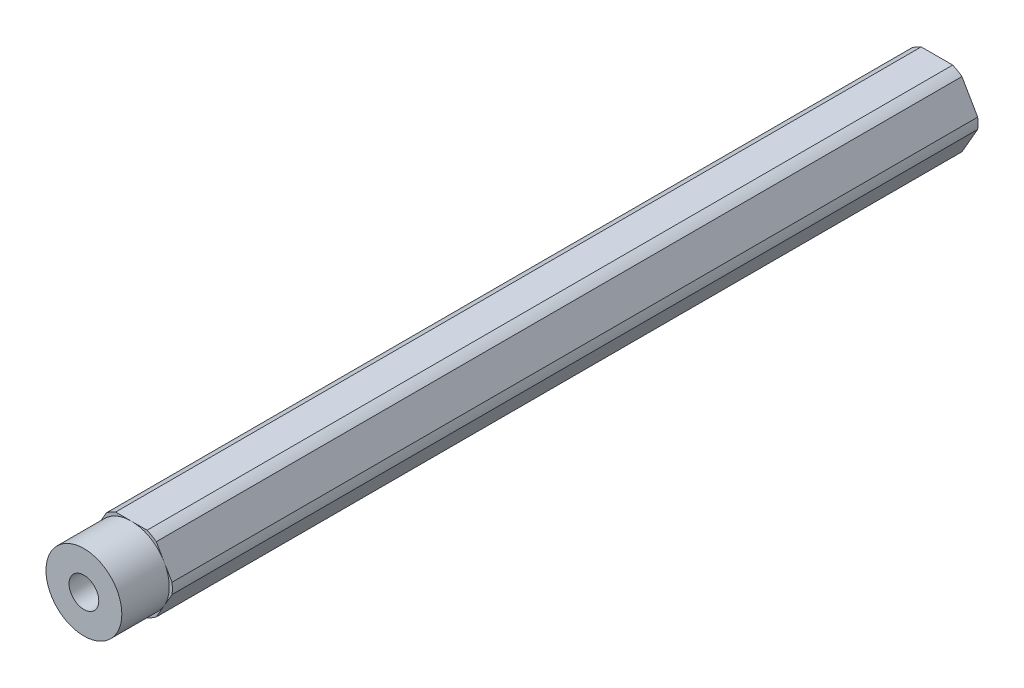
from build123d import *

# Parameters (mm, degrees)
BOSS_EXTRUDE1_DEPTH              = 67.44335
SKETCH4_R                        = 6.35
SKETCH4_R_2                      = 2.4892
BOSS_EXTRUDE2_DEPTH              = 7.9375
F_10_32_TAPPED_HOLE1_D           = 4.0386
F_10_32_TAPPED_HOLE1_CSINK_D     = 6.096
F_10_32_TAPPED_HOLE1_CSINK_ANGLE = 90


with BuildPart() as part:
    # Sketch1 → Boss-Extrude1 (new, symmetric)
    with BuildSketch(Plane.XY):
        with BuildLine():
            ThreePointArc((4.181770846, 5.456960429), (3.437499983, 5.953924622), (2.634980936, 6.35))
            Line((2.634980936, 6.35), (-2.634980936, 6.35))
            ThreePointArc((-2.634980936, 6.35), (-3.437499983, 5.953924622), (-4.181770846, 5.456960429))
            Line((-4.181770846, 5.456960429), (-6.816751782, 0.893039571))
            ThreePointArc((-6.816751782, 0.893039571), (-6.874999966, 0), (-6.816751782, -0.893039571))
            Line((-6.816751782, -0.893039571), (-4.181770846, -5.456960429))
            ThreePointArc((-4.181770846, -5.456960429), (-3.437499983, -5.953924622), (-2.634980936, -6.35))
            Line((-2.634980936, -6.35), (2.634980936, -6.35))
            ThreePointArc((2.634980936, -6.35), (3.437499983, -5.953924622), (4.181770846, -5.456960429))
            Line((4.181770846, -5.456960429), (6.816751782, -0.893039571))
            ThreePointArc((6.816751782, -0.893039571), (6.860422465, -0.447468582), (6.874999966, 0))
            ThreePointArc((6.874999966, 0), (6.860422465, 0.447468582), (6.816751782, 0.893039571))
            Line((6.816751782, 0.893039571), (4.181770846, 5.456960429))
        make_face()
    extrude(amount=BOSS_EXTRUDE1_DEPTH, both=True)

    # Sketch4 → Boss-Extrude2 (add)
    with BuildSketch(Plane.XY.offset(67.44335)):
        with Locations(Location((0, 0, 0), (0, 0, 150))):
            Circle(SKETCH4_R)
        Circle(SKETCH4_R_2, mode=Mode.SUBTRACT)
    extrude(amount=BOSS_EXTRUDE2_DEPTH)

    # #10-32 Tapped Hole1 (through all)
    with Locations(Plane(origin=(0, 0, -67.44335), x_dir=(-1, 0, 0), z_dir=(0, 0, -1))):
        with Locations((0, 0)):
            CounterSinkHole(F_10_32_TAPPED_HOLE1_D / 2, F_10_32_TAPPED_HOLE1_CSINK_D / 2, counter_sink_angle=F_10_32_TAPPED_HOLE1_CSINK_ANGLE)


solid = part.part
